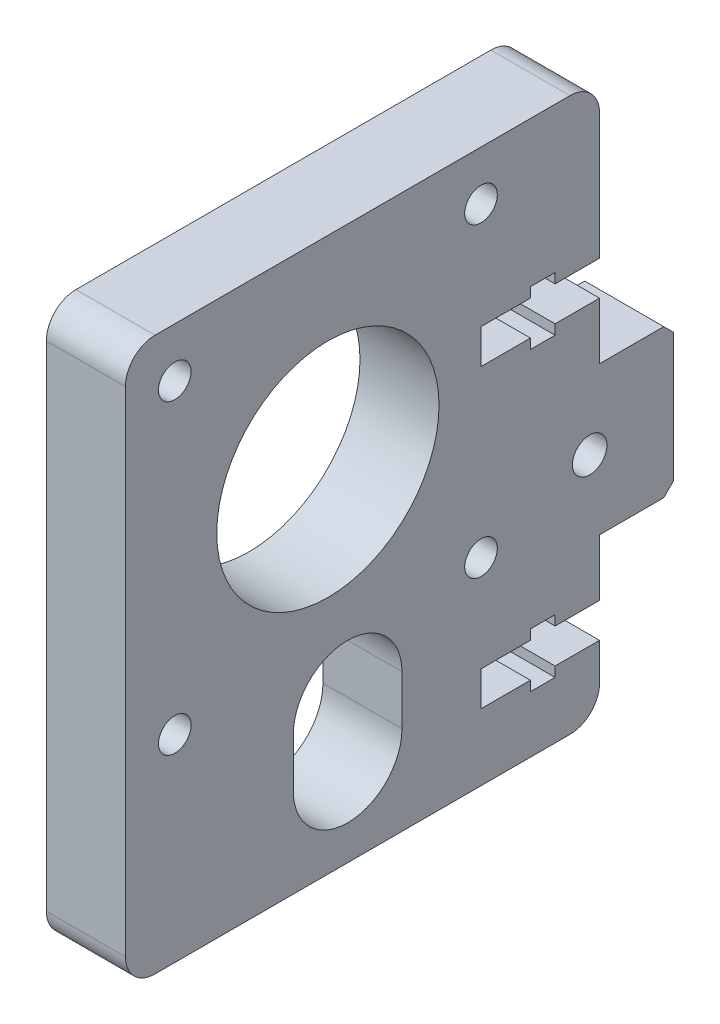
from build123d import *

# Parameters (mm, degrees)
SKETCH1_R      = 1.65
SKETCH1_R_2    = 1.75
EXTRUDE1_DEPTH = 8
SKETCH2_R      = 1
EXTRUDE2_DEPTH = 1
SKETCH3_R      = 1
EXTRUDE3_DEPTH = 1
SKETCH4_R      = 11.25
EXTRUDE4_DEPTH = 10


with BuildPart() as part:
    # Sketch1 → Extrude1 (new body)
    with BuildSketch(Plane(origin=(0, 0, 0), x_dir=(0, 0, -1), z_dir=(1, 0, 0))):
        with BuildLine():
            Line((53.032288553, 11.724414772), (53.032288553, 7.974414772))
            ThreePointArc((53.032288553, 7.974414772), (52.153608896, 5.853094429), (50.032288553, 4.974414772))
            Line((50.032288553, 4.974414772), (8.032288553, 4.974414772))
            ThreePointArc((8.032288553, 4.974414772), (5.910968209, 5.853094429), (5.032288553, 7.974414772))
            Line((5.032288553, 7.974414772), (5.032288553, 57.974414772))
            ThreePointArc((5.032288553, 57.974414772), (5.910968209, 60.095735116), (8.032288553, 60.974414772))
            Line((8.032288553, 60.974414772), (50.032288553, 60.974414772))
            ThreePointArc((50.032288553, 60.974414772), (52.153608896, 60.095735116), (53.032288553, 57.974414772))
            Line((53.032288553, 57.974414772), (53.032288553, 45.224414772))
            Line((53.032288553, 45.224414772), (48.532288553, 45.224414772))
            Line((48.532288553, 45.224414772), (48.532288553, 46.224414772))
            Line((48.532288553, 46.224414772), (46.032288553, 46.224414772))
            Line((46.032288553, 46.224414772), (46.032288553, 45.224414772))
            Line((46.032288553, 45.224414772), (41.032288553, 45.224414772))
            Line((41.032288553, 45.224414772), (41.032288553, 41.724414772))
            Line((41.032288553, 41.724414772), (46.032288553, 41.724414772))
            Line((46.032288553, 41.724414772), (46.032288553, 40.724414772))
            Line((46.032288553, 40.724414772), (48.532288553, 40.724414772))
            Line((48.532288553, 40.724414772), (48.532288553, 41.724414772))
            Line((48.532288553, 41.724414772), (53.032288553, 41.724414772))
            Line((53.032288553, 41.724414772), (53.032288553, 35.974414772))
            Line((53.032288553, 35.974414772), (59.532288553, 35.974414772))
            Line((59.532288553, 35.974414772), (60.532288553, 34.974414772))
            Line((60.532288553, 34.974414772), (60.532288553, 21.974414772))
            Line((60.532288553, 21.974414772), (59.532288553, 20.974414772))
            Line((59.532288553, 20.974414772), (53.032288553, 20.974414772))
            Line((53.032288553, 20.974414772), (53.032288553, 15.224414772))
            Line((53.032288553, 15.224414772), (48.532288553, 15.224414772))
            Line((48.532288553, 15.224414772), (48.532288553, 16.224414772))
            Line((48.532288553, 16.224414772), (46.032288553, 16.224414772))
            Line((46.032288553, 16.224414772), (46.032288553, 15.224414772))
            Line((46.032288553, 15.224414772), (41.032288553, 15.224414772))
            Line((41.032288553, 15.224414772), (41.032288553, 11.724414772))
            Line((41.032288553, 11.724414772), (46.032288553, 11.724414772))
            Line((46.032288553, 11.724414772), (46.032288553, 10.724414772))
            Line((46.032288553, 10.724414772), (48.532288553, 10.724414772))
            Line((48.532288553, 10.724414772), (48.532288553, 11.724414772))
            Line((48.532288553, 11.724414772), (53.032288553, 11.724414772))
        make_face()
        with Locations((41.032288553, 55.974414772)):
            Circle(SKETCH1_R, mode=Mode.SUBTRACT)
        with Locations((10.032288553, 55.974414772)):
            Circle(SKETCH1_R, mode=Mode.SUBTRACT)
        with Locations((41.032288553, 24.974414772)):
            Circle(SKETCH1_R, mode=Mode.SUBTRACT)
        with Locations((10.032288553, 24.974414772)):
            Circle(SKETCH1_R, mode=Mode.SUBTRACT)
        with Locations((52.032288553, 28.474414772)):
            Circle(SKETCH1_R_2, mode=Mode.SUBTRACT)
        with BuildLine():
            Line((22.032288553, 18.974414772), (22.032288553, 13.974414772))
            ThreePointArc((22.032288553, 13.974414772), (27.532288553, 8.474414772), (33.032288553, 13.974414772))
            Line((33.032288553, 13.974414772), (33.032288553, 18.974414772))
            ThreePointArc((33.032288553, 18.974414772), (27.532288553, 24.474414772), (22.032288553, 18.974414772))
        make_face(mode=Mode.SUBTRACT)
    extrude(amount=EXTRUDE1_DEPTH)

    # Sketch2 → Extrude2 (cut)
    with BuildSketch(Plane(origin=(0, 0, -41.032288553), x_dir=(-1, 0, 0), z_dir=(0, 0, -1))):
        with Locations((-4, 43.474414772)):
            Circle(SKETCH2_R)
    extrude(amount=-EXTRUDE2_DEPTH, mode=Mode.SUBTRACT)

    # Sketch3 → Extrude3 (cut)
    with BuildSketch(Plane(origin=(0, 0, -41.032288553), x_dir=(-1, 0, 0), z_dir=(0, 0, -1))):
        with Locations((-4, 13.474414772)):
            Circle(SKETCH3_R)
    extrude(amount=-EXTRUDE3_DEPTH, mode=Mode.SUBTRACT)

    # Sketch4 → Extrude4 (cut)
    with BuildSketch(Plane(origin=(8, 0, 0), x_dir=(0, 0, -1), z_dir=(1, 0, 0))):
        with Locations((25.532288553, 40.474414772)):
            Circle(SKETCH4_R)
    extrude(amount=-EXTRUDE4_DEPTH, mode=Mode.SUBTRACT)


solid = part.part
